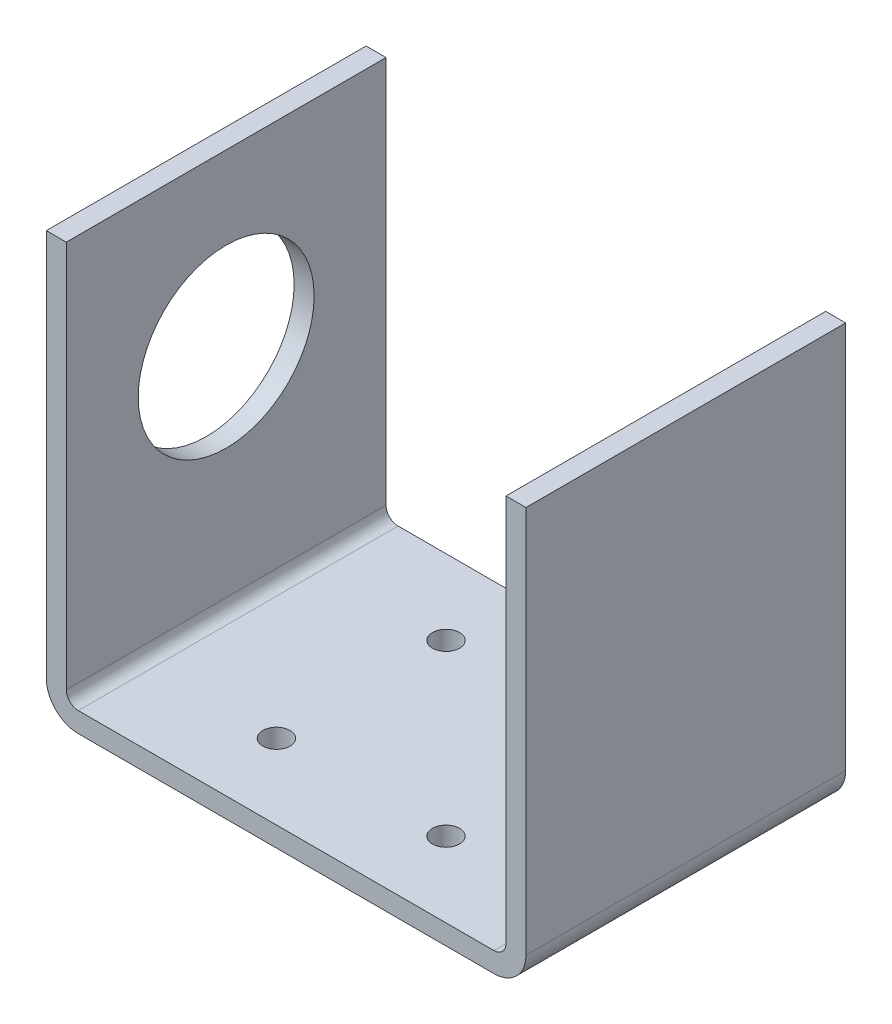
from build123d import *

# Parameters (mm, degrees)
SKETCH1_W                      = 60
SKETCH1_H                      = 40
BOSS_EXTRUDE1_DEPTH            = 2.5
M3_CLEARANCE_HOLE1_D           = 3.4
SKETCH4_W                      = 2.5
SKETCH4_H                      = 50
BOSS_EXTRUDE2_DEPTH            = 40
FILLET1_R                      = 4
FILLET2_R                      = 1.5
CUT_EXTRUDE1_REACH             = 84.196
SKETCH6_R                      = 11
CUT_EXTRUDE1_DIRECTION_2_DEPTH = 83.196411114


with BuildPart() as part:
    # Sketch1 → Boss-Extrude1 (new body)
    with BuildSketch(Plane(origin=(0, 0, 0), x_dir=(1, 0, 0), z_dir=(0, 1, 0))):
        Rectangle(SKETCH1_W, SKETCH1_H)
    extrude(amount=BOSS_EXTRUDE1_DEPTH)

    # M3 Clearance Hole1 (through all)
    with Locations(Plane(origin=(0, 2.5, 0), x_dir=(1, 0, 0), z_dir=(0, 1, 0))):
        with Locations((-10.606601718, 10.606601718), (10.606601718, 10.606601718), (10.606601718, -10.606601718), (-10.606601718, -10.606601718)):
            Hole(M3_CLEARANCE_HOLE1_D / 2)

    # Sketch4 → Boss-Extrude2 (add)
    with BuildSketch(Plane.XY.offset(20)):
        with Locations((-28.75, 27.5)):
            Rectangle(SKETCH4_W, SKETCH4_H)
        with Locations((28.75, 27.5)):
            Rectangle(SKETCH4_W, SKETCH4_H)
    extrude(amount=-BOSS_EXTRUDE2_DEPTH)

    # Fillet1
    fillet1_edges = [part.edges().sort_by_distance(p)[0] for p in [
        (-30, 0, 0),
        (30, 0, 0),
    ]]
    fillet(fillet1_edges, radius=FILLET1_R)

    # Fillet2
    fillet2_edges = [part.edges().sort_by_distance(p)[0] for p in [
        (-27.5, 2.5, 0),
        (27.5, 2.5, 0),
    ]]
    fillet(fillet2_edges, radius=FILLET2_R)

    # Sketch6 → Cut-Extrude1 (cut, up to next)
    with BuildSketch(Plane.ZY.offset(30), mode=Mode.PRIVATE) as cut_extrude1_sk1:
        with Locations(Location((0, 31.17493075, 0), (0, 0, 180))):
            Circle(SKETCH6_R)
    cut_extrude1_tool1 = extrude(cut_extrude1_sk1.sketch, amount=-CUT_EXTRUDE1_REACH, mode=Mode.PRIVATE) & part.part
    add(cut_extrude1_tool1.solids().sort_by_distance((-30, 31.174931, 0))[0], mode=Mode.SUBTRACT)

    # Sketch6 → Cut-Extrude1 direction 2 (cut)
    with BuildSketch(Plane.ZY.offset(30)):
        with Locations(Location((0, 31.17493075, 0), (0, 0, 180))):
            Circle(SKETCH6_R)
    extrude(amount=CUT_EXTRUDE1_DIRECTION_2_DEPTH, mode=Mode.SUBTRACT)


solid = part.part
